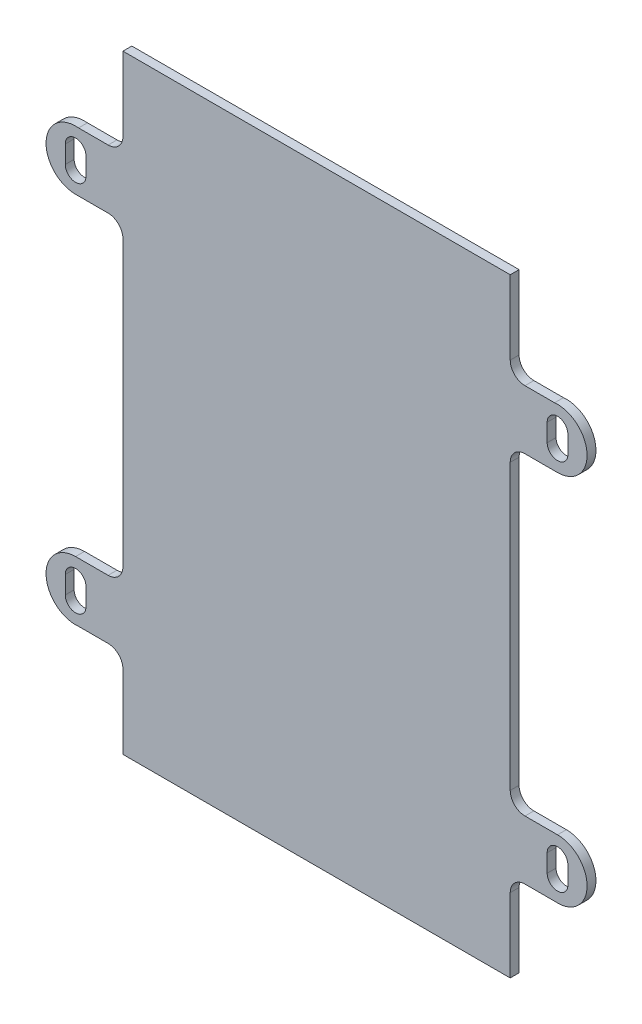
from build123d import *

# Parameters (mm, degrees)
BOSS_EXTRUDE1_DEPTH = 3


with BuildPart() as part:
    # Sketch2 → Boss-Extrude1 (new body)
    with BuildSketch(Plane.XY):
        with BuildLine():
            Line((-65.5, -103), (65.5, -103))
            Line((65.5, -103), (65.5, -78))
            ThreePointArc((65.5, -78), (66.964466094, -74.464466094), (70.5, -73))
            Line((70.5, -73), (80.5, -73))
            ThreePointArc((80.5, -73), (91.487460731, -63.55075338), (81.5, -53.050125629))
            Line((81.5, -53.050125629), (70.5, -53.050125629))
            ThreePointArc((70.5, -53.050125629), (66.964466094, -51.585659535), (65.5, -48.050125629))
            Line((65.5, -48.050125629), (65.5, 48.050125629))
            ThreePointArc((65.5, 48.050125629), (66.964466094, 51.585659535), (70.5, 53.050125629))
            Line((70.5, 53.050125629), (81.5, 53.050125629))
            ThreePointArc((81.5, 53.050125629), (91.487460731, 63.55075338), (80.5, 73))
            Line((80.5, 73), (70.5, 73))
            ThreePointArc((70.5, 73), (66.964466094, 74.464466094), (65.5, 78))
            Line((65.5, 78), (65.5, 103))
            Line((65.5, 103), (-65.5, 103))
            Line((-65.5, 103), (-65.5, 78))
            ThreePointArc((-65.5, 78), (-66.964466094, 74.464466094), (-70.5, 73))
            Line((-70.5, 73), (-80.5, 73))
            ThreePointArc((-80.5, 73), (-91.487460731, 63.55075338), (-81.5, 53.050125629))
            Line((-81.5, 53.050125629), (-70.5, 53.050125629))
            ThreePointArc((-70.5, 53.050125629), (-66.964466094, 51.585659535), (-65.5, 48.050125629))
            Line((-65.5, 48.050125629), (-65.5, -48.050125629))
            ThreePointArc((-65.5, -48.050125629), (-66.964466094, -51.585659535), (-70.5, -53.050125629))
            Line((-70.5, -53.050125629), (-81.5, -53.050125629))
            ThreePointArc((-81.5, -53.050125629), (-91.487460731, -63.55075338), (-80.5, -73))
            Line((-80.5, -73), (-70.5, -73))
            ThreePointArc((-70.5, -73), (-66.964466094, -74.464466094), (-65.5, -78))
            Line((-65.5, -78), (-65.5, -103))
        make_face()
        with BuildLine():
            Line((78, 60.050125629), (78, 66.050125629))
            ThreePointArc((78, 66.050125629), (81.5, 69.550125629), (85, 66.050125629))
            Line((85, 66.050125629), (85, 60.050125629))
            ThreePointArc((85, 60.050125629), (81.5, 56.550125629), (78, 60.050125629))
        make_face(mode=Mode.SUBTRACT)
        with BuildLine():
            Line((-78, 60.050125629), (-78, 66.050125629))
            ThreePointArc((-78, 66.050125629), (-81.5, 69.550125629), (-85, 66.050125629))
            Line((-85, 66.050125629), (-85, 60.050125629))
            ThreePointArc((-85, 60.050125629), (-81.5, 56.550125629), (-78, 60.050125629))
        make_face(mode=Mode.SUBTRACT)
        with BuildLine():
            Line((-78, -60.050125629), (-78, -66.050125629))
            ThreePointArc((-78, -66.050125629), (-81.5, -69.550125629), (-85, -66.050125629))
            Line((-85, -66.050125629), (-85, -60.050125629))
            ThreePointArc((-85, -60.050125629), (-81.5, -56.550125629), (-78, -60.050125629))
        make_face(mode=Mode.SUBTRACT)
        with BuildLine():
            Line((78, -60.050125629), (78, -66.050125629))
            ThreePointArc((78, -66.050125629), (81.5, -69.550125629), (85, -66.050125629))
            Line((85, -66.050125629), (85, -60.050125629))
            ThreePointArc((85, -60.050125629), (81.5, -56.550125629), (78, -60.050125629))
        make_face(mode=Mode.SUBTRACT)
    extrude(amount=BOSS_EXTRUDE1_DEPTH)


solid = part.part
